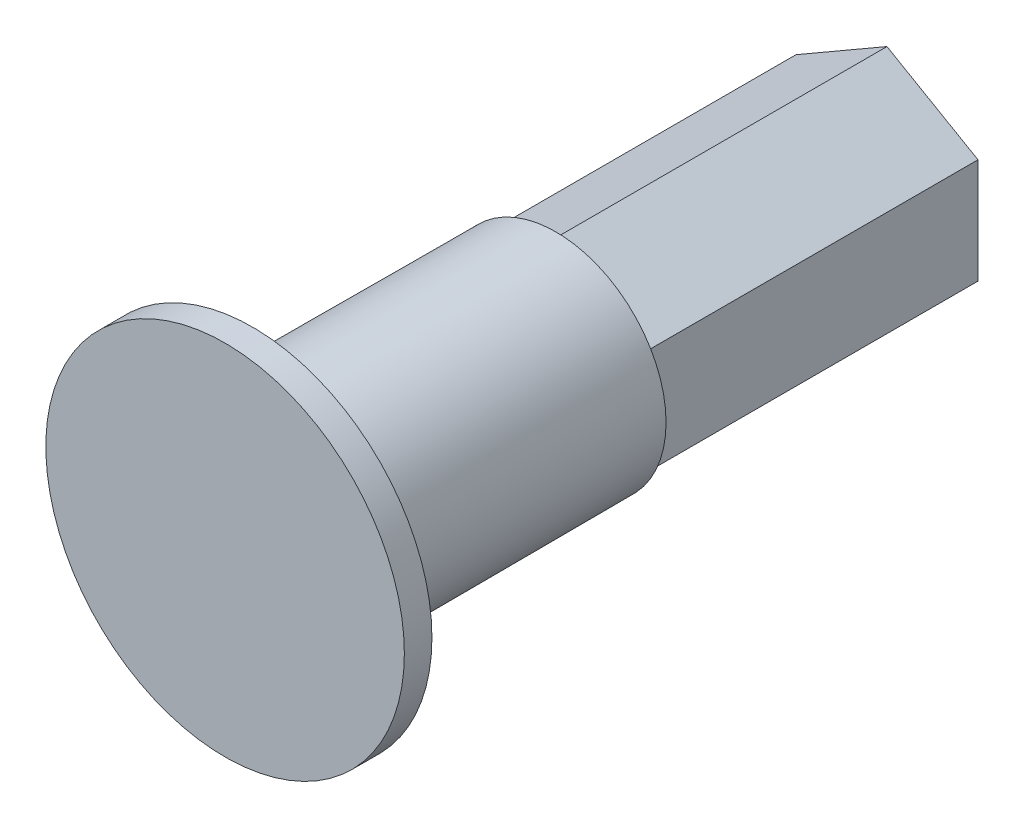
from build123d import *

# Parameters (mm, degrees)
SZKIC4_R                   = 5.19169257
WYTNIJ_WYCI_GNI_CIE3_DEPTH = 12


with BuildPart() as part:
    # Szkic3 → Obrót1 (revolve)
    with BuildSketch(Plane(origin=(0, 0, 0), x_dir=(0, 0, -1), z_dir=(1, 0, 0))):
        Polygon((0, 0), (0, 6.5), (1, 6.5), (1, 4.025), (24, 3.95), (24, 0), align=None)
    revolve(axis=Axis((0, 0, 0), (0, 0, -1)))

    # Szkic4 → Wytnij-wyciągnięcie3 (cut)
    with BuildSketch(Plane(origin=(0, 0, -24), x_dir=(-1, 0, 0), z_dir=(0, 0, -1))):
        Circle(SZKIC4_R)
        Polygon((0, 3.810511777), (-3.3, 1.905255888), (-3.3, -1.905255888), (0, -3.810511777), (3.3, -1.905255888), (3.3, 1.905255888), align=None, mode=Mode.SUBTRACT)
    extrude(amount=-WYTNIJ_WYCI_GNI_CIE3_DEPTH, mode=Mode.SUBTRACT)


solid = part.part
